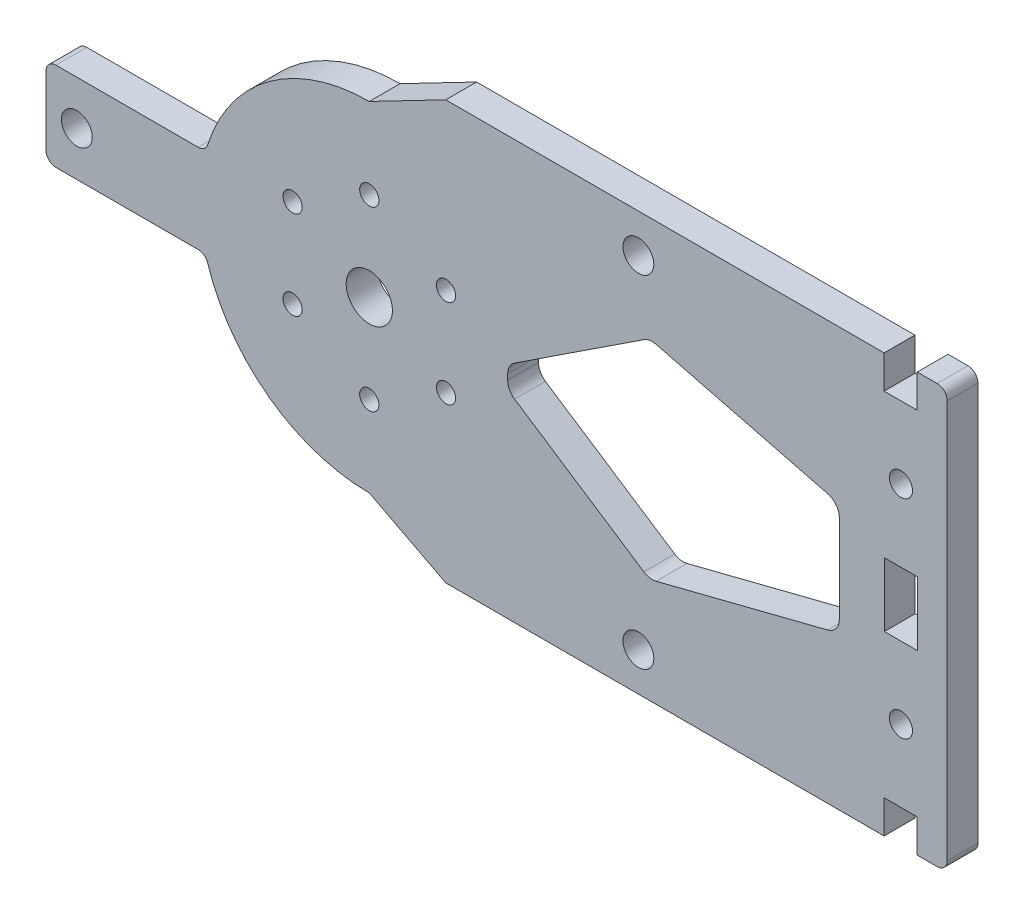
from build123d import *

# Parameters (mm, degrees)
SKETCH_1_R      = 1.5
SKETCH_1_R_2    = 3
SKETCH_1_R_3    = 1.25
SKETCH_1_R_4    = 2
SKETCH_1_W      = 4.3
SKETCH_1_H      = 8.3
EXTRUDE_1_DEPTH = 4
FILLET_1_R      = 1.3
FILLET_2_R      = 2


with BuildPart() as part:
    # 草图1 → 凸台-拉伸1 (new body)
    with BuildSketch(Plane.XY):
        with BuildLine():
            Line((32.115707856, 27.15), (32.115707856, 22.85))
            Line((32.115707856, 22.85), (27.815707856, 22.85))
            Line((27.815707856, 22.85), (27.815707856, 27.15))
            Line((27.815707856, 27.15), (-29.075, 27.15))
            Line((-29.075, 27.15), (-38.998995168, 22.002009663))
            ThreePointArc((-38.998995168, 22.002009663), (-52.370174504, 17.472835843), (-60.236366221, 5.75))
            Line((-60.236366221, 5.75), (-80.958287312, 5.75))
            Line((-80.958287312, 5.75), (-80.958287312, -5.75))
            Line((-80.958287312, -5.75), (-60.236366221, -5.75))
            ThreePointArc((-60.236366221, -5.75), (-52.370174504, -17.472835843), (-38.998995168, -22.002009663))
            Line((-38.998995168, -22.002009663), (-29.075, -27.15))
            Line((-29.075, -27.15), (27.815707856, -27.15))
            Line((27.815707856, -27.15), (27.815707856, -22.85))
            Line((27.815707856, -22.85), (32.115707856, -22.85))
            Line((32.115707856, -22.85), (32.115707856, -27.15))
            Line((32.115707856, -27.15), (36.001004832, -27.15))
            Line((36.001004832, -27.15), (36.001004832, 27.15))
            Line((36.001004832, 27.15), (32.115707856, 27.15))
        make_face()
        with Locations((30.001004832, 13.5)):
            Circle(SKETCH_1_R, mode=Mode.SUBTRACT)
        with Locations(Location((30.001004832, -13.5, 0), (0, 0, 180))):
            Circle(SKETCH_1_R, mode=Mode.SUBTRACT)
        with Locations((-38.998995168, 0)):
            Circle(SKETCH_1_R_2, mode=Mode.SUBTRACT)
        with Locations((-38.998995168, -11.5)):
            Circle(SKETCH_1_R_3, mode=Mode.SUBTRACT)
        with Locations((-48.958287312, -5.75)):
            Circle(SKETCH_1_R_3, mode=Mode.SUBTRACT)
        with Locations((-48.958287312, 5.75)):
            Circle(SKETCH_1_R_3, mode=Mode.SUBTRACT)
        with Locations((-38.998995168, 11.5)):
            Circle(SKETCH_1_R_3, mode=Mode.SUBTRACT)
        with Locations((-29.039703025, 5.75)):
            Circle(SKETCH_1_R_3, mode=Mode.SUBTRACT)
        with Locations((-29.039703025, -5.75)):
            Circle(SKETCH_1_R_3, mode=Mode.SUBTRACT)
        with Locations((-4.075, -22.15)):
            Circle(SKETCH_1_R_4, mode=Mode.SUBTRACT)
        with Locations((-4.075, 22.15)):
            Circle(SKETCH_1_R_4, mode=Mode.SUBTRACT)
        with Locations((-76.958287312, 0)):
            Circle(SKETCH_1_R_4, mode=Mode.SUBTRACT)
        with Locations((30.001004832, 0)):
            Rectangle(SKETCH_1_W, SKETCH_1_H, mode=Mode.SUBTRACT)
        Polygon((-2.627787708, -13.528909152), (22.001004832, -7.277030256), (22.001004832, 7.277030256), (-2.627787708, 13.528909152), (-21.039703025, 1.433615613), (-21.039703025, -1.433615613), align=None, mode=Mode.SUBTRACT)
    extrude(amount=EXTRUDE_1_DEPTH)

    # 圆角1
    fillet_1_edges = [part.edges().sort_by_distance(p)[0] for p in [
        (-60.236366221, -5.75, 2),
        (-80.958287312, -5.75, 2),
        (-80.958287312, 5.75, 2),
        (-60.236366221, 5.75, 2),
        (36.001004832, 27.15, 2),
        (36.001004832, -27.15, 2),
    ]]
    fillet(fillet_1_edges, radius=FILLET_1_R)

    # 圆角2
    fillet_2_edges = [part.edges().sort_by_distance(p)[0] for p in [
        (-21.039703025, -1.433615613, 2),
        (-2.627787708, -13.528909152, 2),
        (22.001004832, -7.277030256, 2),
        (22.001004832, 7.277030256, 2),
        (-2.627787708, 13.528909152, 2),
        (-21.039703025, 1.433615613, 2),
    ]]
    fillet(fillet_2_edges, radius=FILLET_2_R)


solid = part.part
